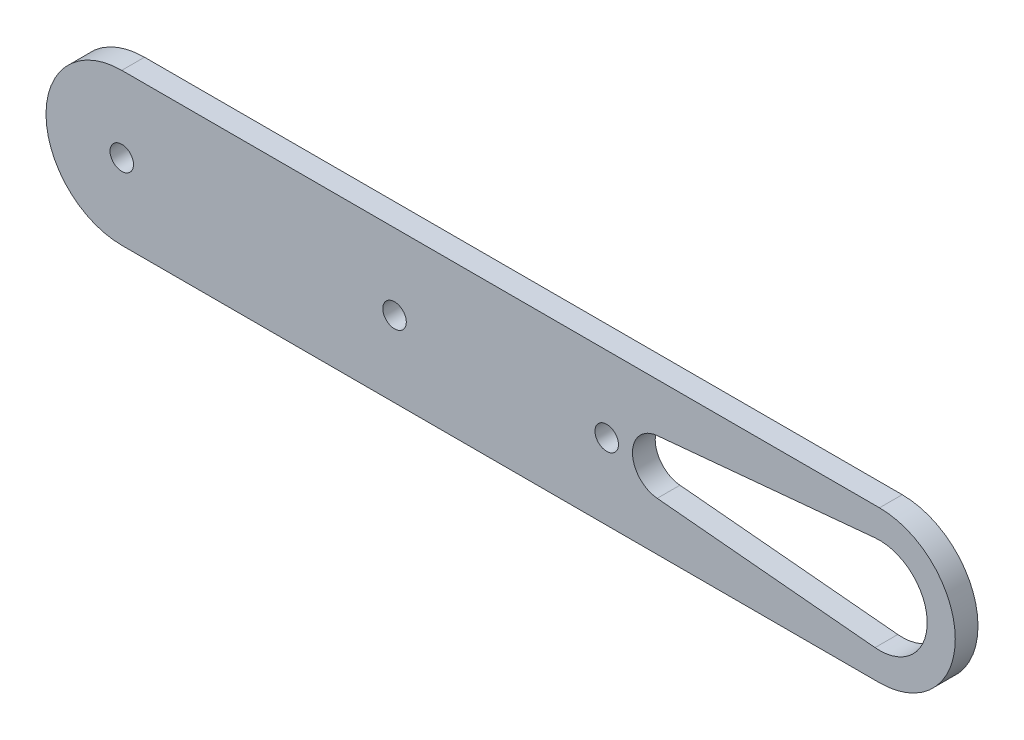
from build123d import *

# Parameters (mm, degrees)
BOSS_EXTRUDE1_DEPTH = 3
SKETCH3_R           = 1.55
CUT_EXTRUDE2_DEPTH  = 3
SKETCH4_R           = 1.55
CUT_EXTRUDE4_DEPTH  = 3
SKETCH5_R           = 1.55
CUT_EXTRUDE6_DEPTH  = 3
CUT_EXTRUDE7_DEPTH  = 3


with BuildPart() as part:
    # Sketch1 → Boss-Extrude1 (new body)
    with BuildSketch(Plane.XY):
        with BuildLine():
            Line((-58.058617241, 24.191090517), (41.941382759, 24.191090517))
            ThreePointArc((41.941382759, 24.191090517), (51.941382759, 14.191090517), (41.941382759, 4.191090517))
            Line((41.941382759, 4.191090517), (-58.058617241, 4.191090517))
            ThreePointArc((-58.058617241, 4.191090517), (-68.058617241, 14.191090517), (-58.058617241, 24.191090517))
        make_face()
    extrude(amount=BOSS_EXTRUDE1_DEPTH)

    # Sketch3 → Cut-Extrude2 (cut)
    with BuildSketch(Plane.XY.offset(3)):
        with Locations((-58.058617241, 14.191090517)):
            Circle(SKETCH3_R)
    extrude(amount=-CUT_EXTRUDE2_DEPTH, mode=Mode.SUBTRACT)

    # Sketch4 → Cut-Extrude4 (cut)
    with BuildSketch(Plane(origin=(9.979459273, 1.433252018, 3), x_dir=(1, 0, 0), z_dir=(0, 0, 1))):
        with Locations((-4.038076514, 12.757838499)):
            Circle(SKETCH4_R)
    extrude(amount=-CUT_EXTRUDE4_DEPTH, mode=Mode.SUBTRACT)

    # Sketch5 → Cut-Extrude6 (cut)
    with BuildSketch(Plane(origin=(-9.979459273, 1.433252018, 0), x_dir=(-1, 0, 0), z_dir=(0, 0, -1))):
        with Locations((12.079157968, 12.757838499)):
            Circle(SKETCH5_R)
    extrude(amount=-CUT_EXTRUDE6_DEPTH, mode=Mode.SUBTRACT)

    # Sketch6 → Cut-Extrude7 (cut)
    with BuildSketch(Plane.XY.offset(3)):
        with BuildLine():
            Line((12.606210345, 17.775453704), (41.354831035, 20.463726093))
            ThreePointArc((41.354831035, 20.463726093), (48.241382759, 14.191090517), (41.354831035, 7.918454941))
            Line((41.354831035, 7.918454941), (12.606210345, 10.60672733))
            ThreePointArc((12.606210345, 10.60672733), (9.341382759, 14.191090517), (12.606210345, 17.775453704))
        make_face()
    extrude(amount=-CUT_EXTRUDE7_DEPTH, mode=Mode.SUBTRACT)


solid = part.part
